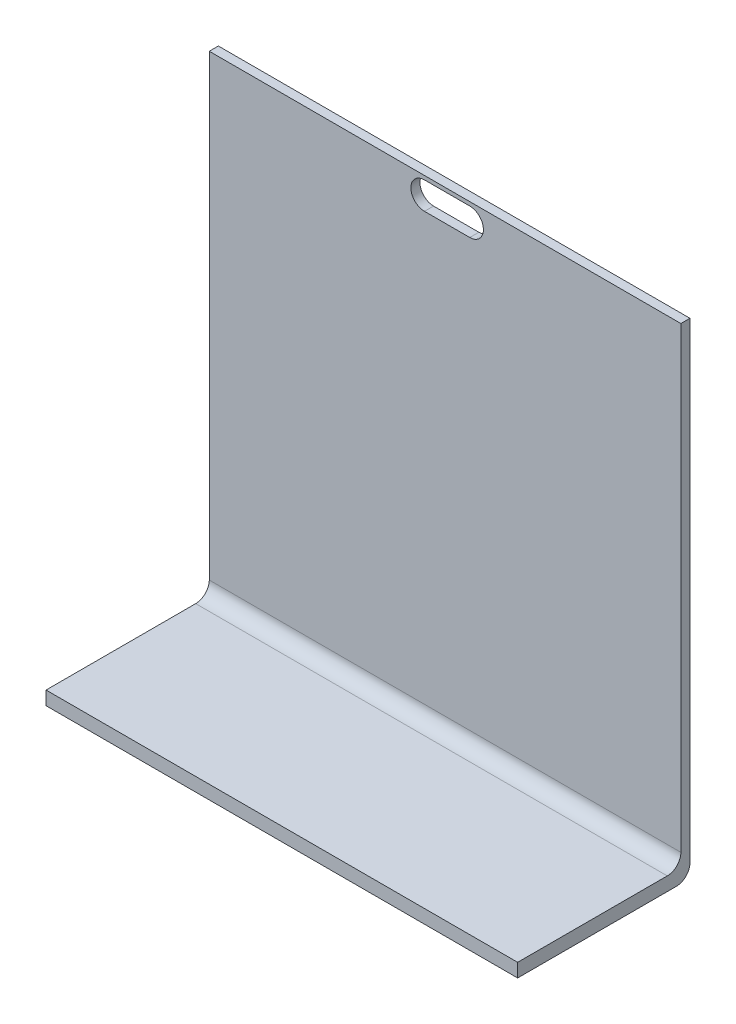
from build123d import *

# Parameters (mm, degrees)
SKETCH_1_W          = 104
SKETCH_1_H          = 38
EXTRUDE_1_DEPTH     = 3
SKETCH_2_W          = 104
SKETCH_2_H          = 2
EXTRUDE_3_DEPTH     = 104
FILLET_1_R          = 3
CUT_EXTRUDE_1_DEPTH = 125.887949779


with BuildPart() as part:
    # 草图1 → 凸台-拉伸1 (new body)
    with BuildSketch(Plane(origin=(0, 0, 0), x_dir=(1, 0, 0), z_dir=(0, 1, 0))):
        Rectangle(SKETCH_1_W, SKETCH_1_H)
    extrude(amount=EXTRUDE_1_DEPTH)

    # 草图2 → 凸台-拉伸3 (add)
    with BuildSketch(Plane(origin=(0, 3, 0), x_dir=(1, 0, 0), z_dir=(0, 1, 0))):
        with Locations((0, 18)):
            Rectangle(SKETCH_2_W, SKETCH_2_H)
    extrude(amount=EXTRUDE_3_DEPTH)

    # 圆角1
    fillet_1_edges = [part.edges().sort_by_distance(p)[0] for p in [
        (0, 3, -17),
        (0, 0, -19),
    ]]
    fillet(fillet_1_edges, radius=FILLET_1_R)

    # 草图4 → 切除-拉伸1 (cut, through all)
    with BuildSketch(Plane(origin=(0, 0, -19), x_dir=(-1, 0, 0), z_dir=(0, 0, -1))):
        with BuildLine():
            Line((-5.452089617, 106.154609435), (4.543778851, 106.154609435))
            ThreePointArc((4.543778851, 106.154609435), (7.543778851, 103.154609435), (4.543778851, 100.154609435))
            Line((4.543778851, 100.154609435), (-5.452089617, 100.154609435))
            ThreePointArc((-5.452089617, 100.154609435), (-8.452089617, 103.154609435), (-5.452089617, 106.154609435))
        make_face()
    extrude(amount=-CUT_EXTRUDE_1_DEPTH, mode=Mode.SUBTRACT)


solid = part.part
